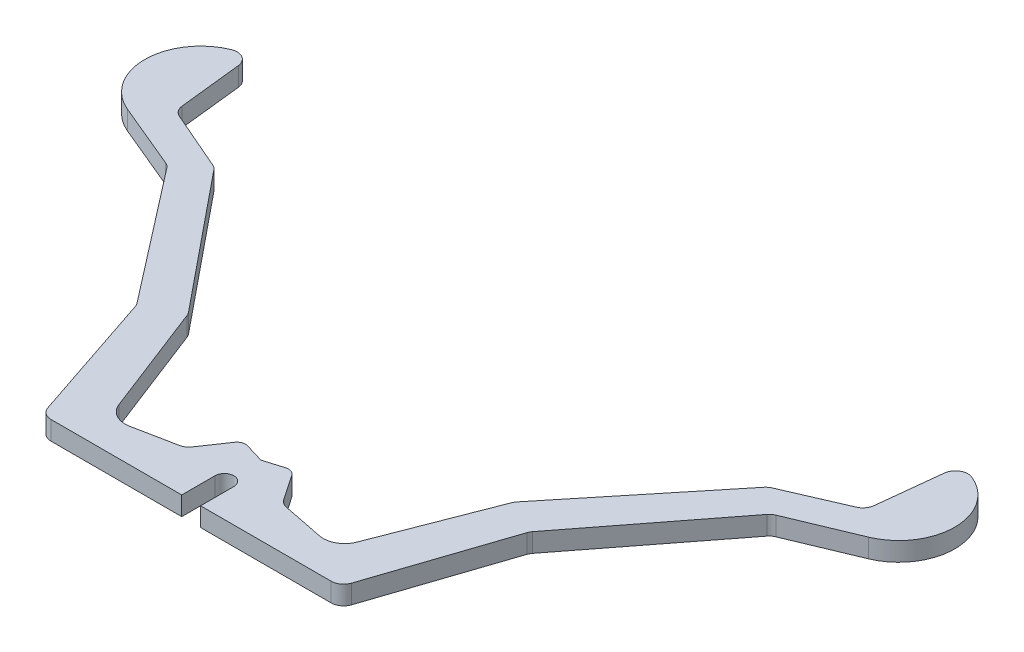
from build123d import *

# Parameters (mm, degrees)
BOSS_EXTRUDE16_DEPTH = 3


with BuildPart() as part:
    # Sketch1 → Boss-Extrude16 (new body)
    with BuildSketch(Plane(origin=(0, 0, 0), x_dir=(1, 0, 0), z_dir=(0, 1, 0))):
        with BuildLine():
            Line((22.300293778, 0), (1.5, 0))
            Line((1.5, 0), (1.5, 5.3))
            ThreePointArc((1.5, 5.3), (0, 6.8), (-1.5, 5.3))
            Line((-1.5, 5.3), (-1.5, 0))
            Line((-1.5, 0), (-22.300293778, 0))
            ThreePointArc((-22.300293778, 0), (-23.468746199, 0.376818266), (-24.196904404, 1.365281059))
            Line((-24.196904404, 1.365281059), (-31.202449054, 22.298625838))
            ThreePointArc((-31.202449054, 22.298625838), (-31.335143696, 22.606562933), (-31.517418983, 22.888003588))
            Line((-31.517418983, 22.888003588), (-47.796410522, 43.921893905))
            ThreePointArc((-47.796410522, 43.921893905), (-48.161779402, 44.28546307), (-48.607932132, 44.543580677))
            Line((-48.607932132, 44.543580677), (-59.049183209, 48.9))
            ThreePointArc((-59.049183209, 48.9), (-64.537582367, 57.177202895), (-58.974890206, 65.404661131))
            ThreePointArc((-58.974890206, 65.404661131), (-57.197152686, 65.269831628), (-56.233330362, 63.769972896))
            Line((-56.233330362, 63.769972896), (-55.126688169, 53.675601541))
            ThreePointArc((-55.126688169, 53.675601541), (-54.747886441, 52.70603833), (-53.9331516, 52.058156621))
            Line((-53.9331516, 52.058156621), (-44.568394969, 48.00411216))
            ThreePointArc((-44.568394969, 48.00411216), (-44.155510387, 47.763109259), (-43.811617548, 47.431004165))
            Line((-43.811617548, 47.431004165), (-26.165884896, 25.744753421))
            ThreePointArc((-26.165884896, 25.744753421), (-25.988120723, 25.487567655), (-25.85260895, 25.205820999))
            Line((-25.85260895, 25.205820999), (-18.96208022, 7.444050869))
            ThreePointArc((-18.96208022, 7.444050869), (-17.421166495, 5.685274236), (-15.11, 5.33))
            Line((-15.11, 5.33), (-8.5424724, 6.639941055))
            ThreePointArc((-8.5424724, 6.639941055), (-7.828892036, 6.934141221), (-7.279856371, 7.476645151))
            Line((-7.279856371, 7.476645151), (-4.560453498, 11.47555039))
            ThreePointArc((-4.560453498, 11.47555039), (-3.880556824, 12), (-3.022136693, 12.020536776))
            Line((-3.022136693, 12.020536776), (0, 11.11))
            Line((0, 11.11), (3.022136693, 12.020536776))
            ThreePointArc((3.022136693, 12.020536776), (3.880556824, 12), (4.560453498, 11.47555039))
            Line((4.560453498, 11.47555039), (7.279856371, 7.476645151))
            ThreePointArc((7.279856371, 7.476645151), (7.828892036, 6.934141221), (8.5424724, 6.639941055))
            Line((8.5424724, 6.639941055), (15.11, 5.33))
            ThreePointArc((15.11, 5.33), (17.421166495, 5.685274236), (18.96208022, 7.444050869))
            Line((18.96208022, 7.444050869), (25.85260895, 25.205820999))
            ThreePointArc((25.85260895, 25.205820999), (25.988120723, 25.487567655), (26.165884896, 25.744753421))
            Line((26.165884896, 25.744753421), (43.811617548, 47.431004165))
            ThreePointArc((43.811617548, 47.431004165), (44.155510387, 47.763109259), (44.568394969, 48.00411216))
            Line((44.568394969, 48.00411216), (53.9331516, 52.058156621))
            ThreePointArc((53.9331516, 52.058156621), (54.747886441, 52.70603833), (55.126688169, 53.675601541))
            Line((55.126688169, 53.675601541), (56.233330362, 63.769972896))
            ThreePointArc((56.233330362, 63.769972896), (57.197152686, 65.269831628), (58.974890206, 65.404661131))
            ThreePointArc((58.974890206, 65.404661131), (64.537582367, 57.177202895), (59.049183209, 48.9))
            Line((59.049183209, 48.9), (48.607932132, 44.543580677))
            ThreePointArc((48.607932132, 44.543580677), (48.161779402, 44.28546307), (47.796410522, 43.921893905))
            Line((47.796410522, 43.921893905), (31.517418983, 22.888003588))
            ThreePointArc((31.517418983, 22.888003588), (31.335143696, 22.606562933), (31.202449054, 22.298625838))
            Line((31.202449054, 22.298625838), (24.196904404, 1.365281059))
            ThreePointArc((24.196904404, 1.365281059), (23.468746199, 0.376818266), (22.300293778, 0))
        make_face()
    extrude(amount=BOSS_EXTRUDE16_DEPTH)


solid = part.part
